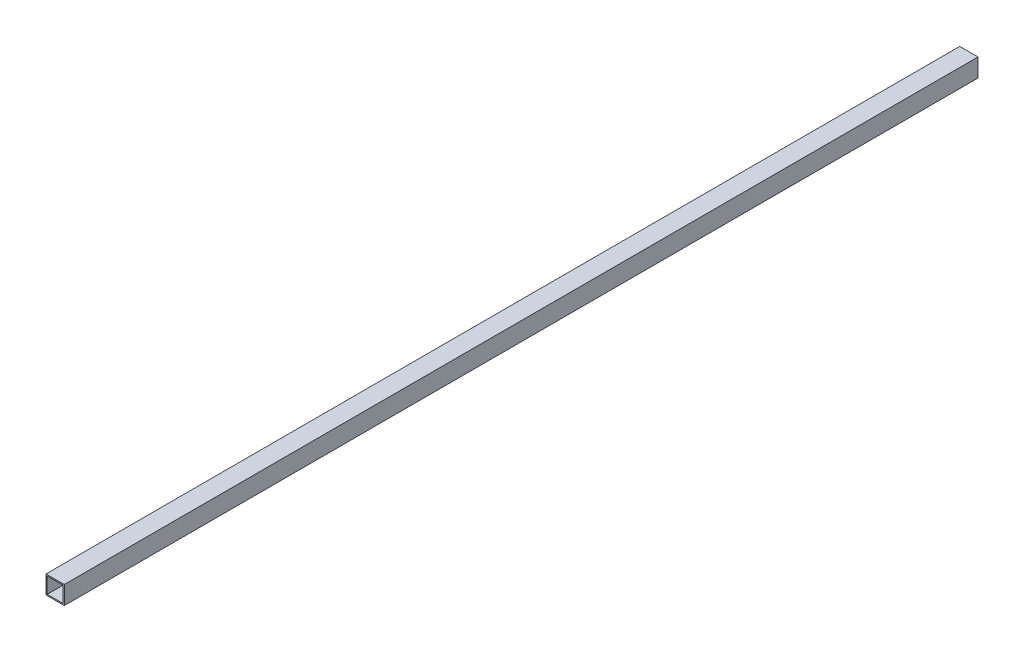
from build123d import *

# Parameters (mm, degrees)
EXTRUDE_1_DEPTH = 1500


with BuildPart() as part:
    # Эскиз1 → Бобышка-Вытянуть1 (new body)
    with BuildSketch(Plane.XY):
        Polygon((2, 2), (28, 2), (30, 0), (0, 0), (0, 30), (2, 28), align=None)
        Polygon((2, 28), (28, 28), (28, 2), (30, 0), (30, 30), (0, 30), align=None)
    extrude(amount=EXTRUDE_1_DEPTH)


solid = part.part
